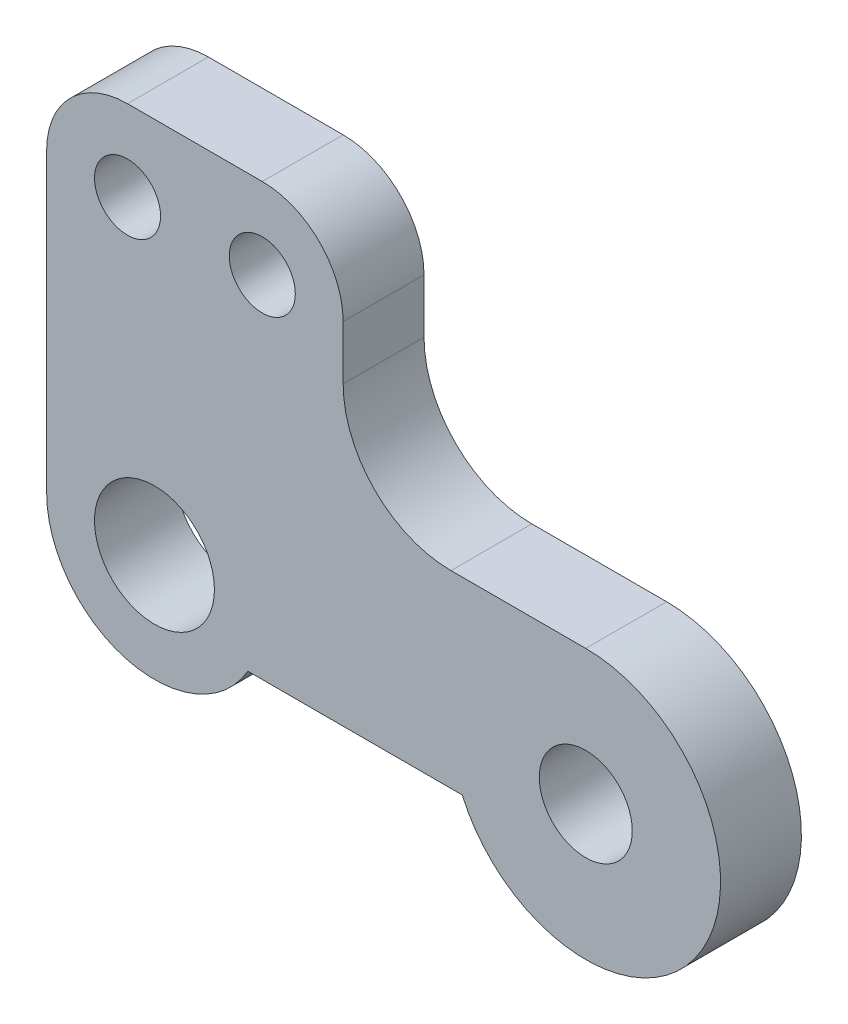
from build123d import *

# Parameters (mm, degrees)
SKETCH1_R           = 2.225
SKETCH1_R_2         = 1.725
SKETCH1_R_3         = 1.225
BOSS_EXTRUDE1_DEPTH = 3
FILLET1_R           = 4


with BuildPart() as part:
    # Sketch1 → Boss-Extrude1 (new body)
    with BuildSketch(Plane.XY):
        with BuildLine():
            Line((3.464101615, -2), (11.417424305, -2))
            ThreePointArc((11.417424305, -2), (20.183300133, -2.738612788), (16, 5))
            Line((16, 5), (7, 5))
            Line((7, 5), (7, 11))
            ThreePointArc((7, 11), (6.121320344, 13.121320344), (4, 14))
            Line((4, 14), (-1, 14))
            ThreePointArc((-1, 14), (-3.121320344, 13.121320344), (-4, 11))
            Line((-4, 11), (-4, 0))
            ThreePointArc((-4, 0), (-1.03527618, -3.863703305), (3.464101615, -2))
        make_face()
        Circle(SKETCH1_R, mode=Mode.SUBTRACT)
        with Locations((16, 0)):
            Circle(SKETCH1_R_2, mode=Mode.SUBTRACT)
        with Locations((-1, 11)):
            Circle(SKETCH1_R_3, mode=Mode.SUBTRACT)
        with Locations((4, 11)):
            Circle(SKETCH1_R_3, mode=Mode.SUBTRACT)
    extrude(amount=BOSS_EXTRUDE1_DEPTH)

    # Fillet1
    fillet1_edges = [part.edges().sort_by_distance(p)[0] for p in [
        (7, 5, 1.5),
        (16, 5, 1.5),
    ]]
    fillet(fillet1_edges, radius=FILLET1_R)


solid = part.part
